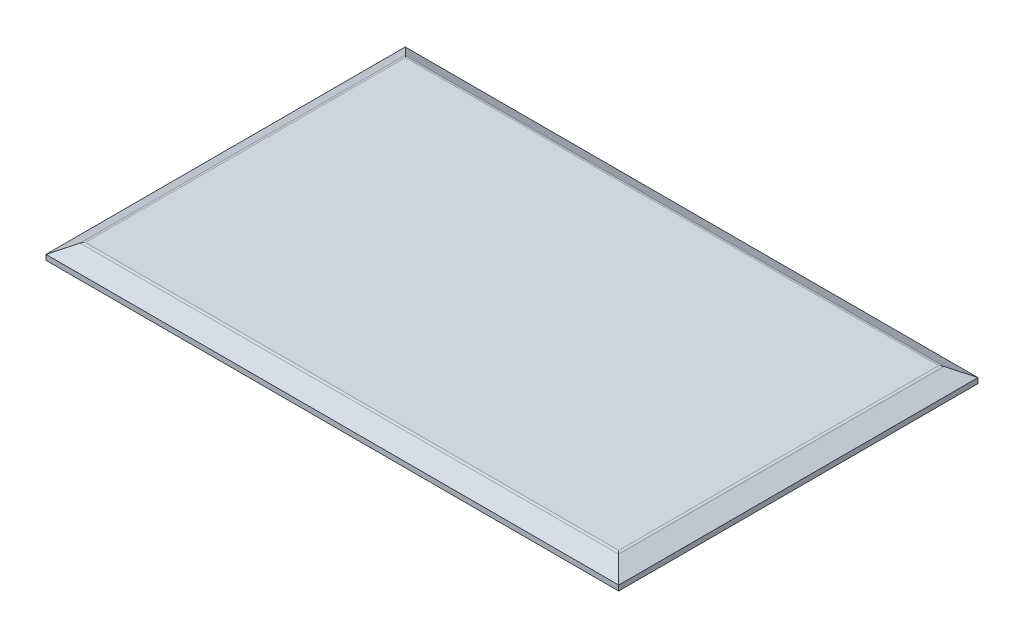
from build123d import *
from OCP.BRepFilletAPI import BRepFilletAPI_MakeChamfer

# Parameters (mm, degrees)
SKETCH1_W           = 110
SKETCH1_H           = 69
BOSS_EXTRUDE1_DEPTH = 3
CHAMFER1_SIZE       = 2
CHAMFER1_SIZE2      = 3.5
FILLET1_R           = 1
SKETCH2_R           = 1.5
BOSS_EXTRUDE2_DEPTH = 0.5


with BuildPart() as part:
    # Sketch1 → Boss-Extrude1 (new body)
    with BuildSketch(Plane(origin=(0, 0, 0), x_dir=(1, 0, 0), z_dir=(0, 1, 0))):
        Rectangle(SKETCH1_W, SKETCH1_H)
    extrude(amount=BOSS_EXTRUDE1_DEPTH)

    # Chamfer1: one chamfer whose edges measure the first distance from different faces: ONE call of the kernel's chamfer builder (chamfer() names one face for all edges)
    chamfer1_edges_1 = [part.edges().sort_by_distance(p)[0] for p in [
        (-55, 3, 0),
    ]]
    chamfer1_side_1 = [part.faces().sort_by_distance(p)[0] for p in [
        (-55, 1.5, 0),
    ]]
    chamfer1_edges_2 = [part.edges().sort_by_distance(p)[0] for p in [
        (0, 3, 34.5),
    ]]
    chamfer1_side_2 = [part.faces().sort_by_distance(p)[0] for p in [
        (0, 1.5, 34.5),
    ]]
    chamfer1_edges_3 = [part.edges().sort_by_distance(p)[0] for p in [
        (55, 3, 0),
    ]]
    chamfer1_side_3 = [part.faces().sort_by_distance(p)[0] for p in [
        (55, 1.5, 0),
    ]]
    chamfer1_edges_4 = [part.edges().sort_by_distance(p)[0] for p in [
        (0, 3, -34.5),
    ]]
    chamfer1_side_4 = [part.faces().sort_by_distance(p)[0] for p in [
        (0, 1.5, -34.5),
    ]]
    chamfer1 = BRepFilletAPI_MakeChamfer(part.part.solid().wrapped)
    for e in chamfer1_edges_1:
        chamfer1.Add(CHAMFER1_SIZE, CHAMFER1_SIZE2, e.wrapped, chamfer1_side_1[0].wrapped)  # the first distance lies on this face
    for e in chamfer1_edges_2:
        chamfer1.Add(CHAMFER1_SIZE, CHAMFER1_SIZE2, e.wrapped, chamfer1_side_2[0].wrapped)  # the first distance lies on this face
    for e in chamfer1_edges_3:
        chamfer1.Add(CHAMFER1_SIZE, CHAMFER1_SIZE2, e.wrapped, chamfer1_side_3[0].wrapped)  # the first distance lies on this face
    for e in chamfer1_edges_4:
        chamfer1.Add(CHAMFER1_SIZE, CHAMFER1_SIZE2, e.wrapped, chamfer1_side_4[0].wrapped)  # the first distance lies on this face
    add(Compound.cast(chamfer1.Shape()), mode=Mode.REPLACE)

    # Fillet1
    fillet1_edges = [part.edges().sort_by_distance(p)[0] for p in [
        (51.5, 3, 0),
        (0, 3, -31),
        (-51.5, 3, 0),
        (0, 3, 31),
    ]]
    fillet(fillet1_edges, radius=FILLET1_R)

    # Sketch2 → Boss-Extrude2 (add)
    with BuildSketch(Plane.XZ):
        with Locations(Location((44, 3.5, 0), (0, 0, 90))):
            Circle(SKETCH2_R)
        with Locations(Location((44, -3.5, 0), (0, 0, 90))):
            Circle(SKETCH2_R)
    extrude(amount=BOSS_EXTRUDE2_DEPTH)


solid = part.part
